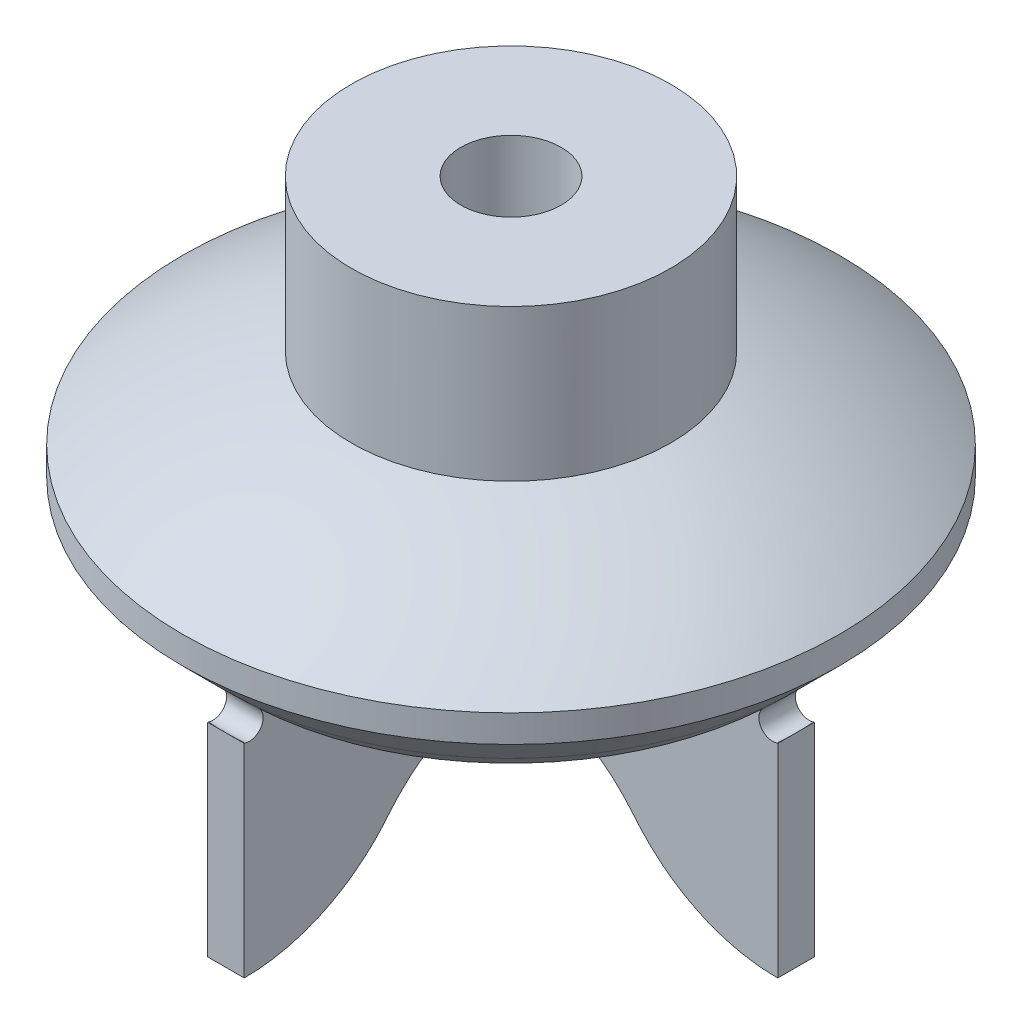
from build123d import *

# Parameters (mm, degrees)
BOSS_EXTRUDE3_REACH = 158.617


with BuildPart() as part:
    # Sketch1 → Revolve2 (revolve)
    with BuildSketch(Plane.XY, mode=Mode.PRIVATE) as revolve2_sk:
        with BuildLine():
            Line((35, 119), (11, 119))
            Line((11, 119), (11, 103))
            Line((11, 103), (20, 103))
            Line((20, 103), (20, 89.208415212))
            ThreePointArc((20, 89.208415212), (27.552175821, 87.744493698), (35, 85.81878842))
            Line((35, 85.81878842), (35, 119))
        make_face()
        with BuildLine():
            ThreePointArc((72, 68), (54.236770785, 78.439269216), (35, 85.81878842))
            ThreePointArc((35, 85.81878842), (27.552175821, 87.744493698), (20, 89.208415212))
            Line((20, 89.208415212), (20, 84))
            Line((20, 84), (0, 84))
            Line((0, 84), (0, 61.80559198))
            ThreePointArc((0, 61.80559198), (30.379588518, 58.696982475), (59.5, 49.5))
            Line((59.5, 49.5), (72, 62))
            Line((72, 62), (72, 68))
        make_face()
    revolve(revolve2_sk.sketch.rotate(Axis((0, 0, 0), (0, 1, 0)), 90), axis=Axis((0, 0, 0), (0, 1, 0)))

    # Sketch3 → Boss-Extrude3 (add, up to next)
    with BuildSketch(Plane(origin=(0, 0, 0), x_dir=(1, 0, 0), z_dir=(0, 1, 0)), mode=Mode.PRIVATE) as boss_extrude3_sk1:
        Polygon((4, -62.5), (-4, -62.5), (-4, -4), (-62.5, -4), (-62.5, 4), (-4, 4), (-4, 62.5), (4, 62.5), (4, 4), (62.5, 4), (62.5, -4), (4, -4), align=None)
    boss_extrude3_tool1 = extrude(boss_extrude3_sk1.sketch, amount=BOSS_EXTRUDE3_REACH, mode=Mode.PRIVATE) - part.part
    add(boss_extrude3_tool1.solids().sort_by_distance((0, 0, 0))[0])

    # Sketch4 → Cut-Revolve5 (revolve, cut)
    with BuildSketch(Plane.XY, mode=Mode.PRIVATE) as cut_revolve5_sk:
        with BuildLine():
            Line((0, 30.062539111), (0, 0))
            Line((0, 0), (-62.5, 0))
            ThreePointArc((-62.5, 0), (-45.161447837, 3.953160903), (-31.25, 15.031269556))
            ThreePointArc((-31.25, 15.031269556), (-17.338552163, 26.109378208), (0, 30.062539111))
        make_face()
        with BuildLine():
            Line((62.5, 44.553447711), (62.983900013, 44.553447711))
            Line((62.983900013, 44.553447711), (62.983900013, 53.111769209))
            Line((62.983900013, 53.111769209), (62.5, 52.627869196))
            add(Edge.make_bspline(
                [(62.5, 52.627869196), (61.455187427, 51.585189848), (60.410321703, 50.542563818), (59.36539396, 49.5)],
                knots=[0, 0, 0, 0, 1, 1, 1, 1], degree=3))
            ThreePointArc((59.36539396, 49.5), (58.950267973, 45.77046827), (62.5, 44.553447711))
        make_face()
    revolve(cut_revolve5_sk.sketch.rotate(Axis((0, 0, 0), (0, 1, 0)), 270), axis=Axis((0, 0, 0), (0, 1, 0)), mode=Mode.SUBTRACT)


solid = part.part
